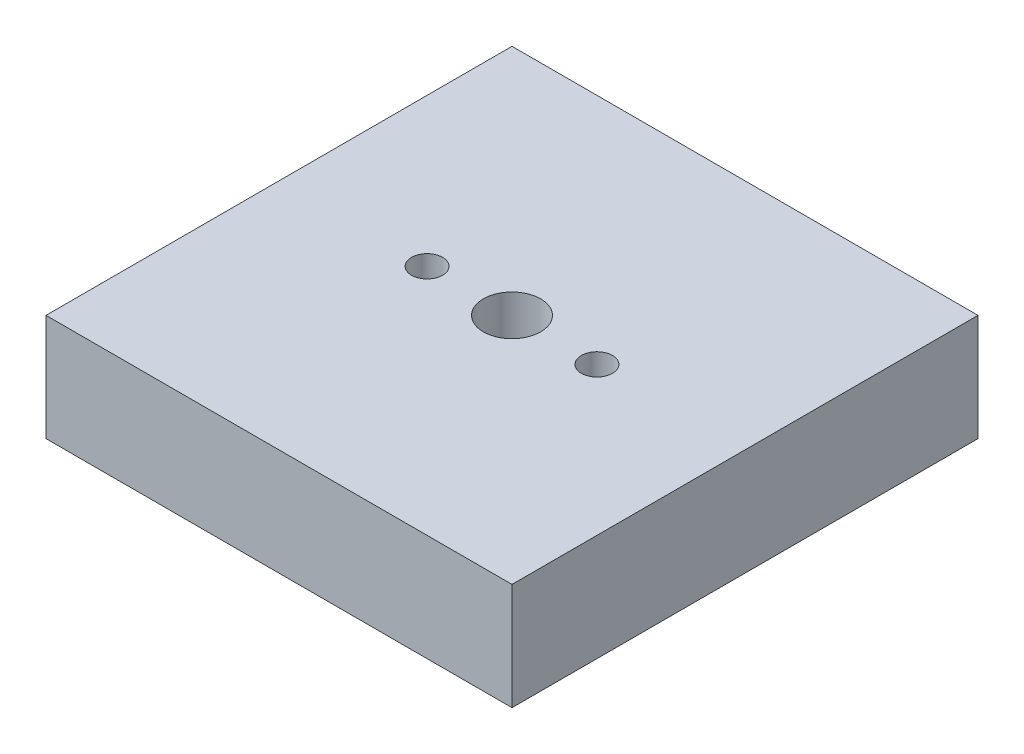
from build123d import *

# Parameters (mm, degrees)
SKETCH1_W           = 9.6
SKETCH1_H           = 9.6
SKETCH1_R           = 0.59
SKETCH1_R_2         = 0.32
BOSS_EXTRUDE1_DEPTH = 2.2


with BuildPart() as part:
    # Sketch1 → Boss-Extrude1 (new body)
    with BuildSketch(Plane(origin=(0, 0, 0), x_dir=(1, 0, 0), z_dir=(0, 1, 0))):
        with Locations((4.8, 4.8)):
            Rectangle(SKETCH1_W, SKETCH1_H)
        with Locations(Location((4.8, 4.8, 0), (0, 0, 270))):
            Circle(SKETCH1_R, mode=Mode.SUBTRACT)
        with Locations(Location((3.05, 4.8, 0), (0, 0, 270))):
            Circle(SKETCH1_R_2, mode=Mode.SUBTRACT)
        with Locations(Location((6.55, 4.8, 0), (0, 0, 270))):
            Circle(SKETCH1_R_2, mode=Mode.SUBTRACT)
    extrude(amount=BOSS_EXTRUDE1_DEPTH)


solid = part.part
